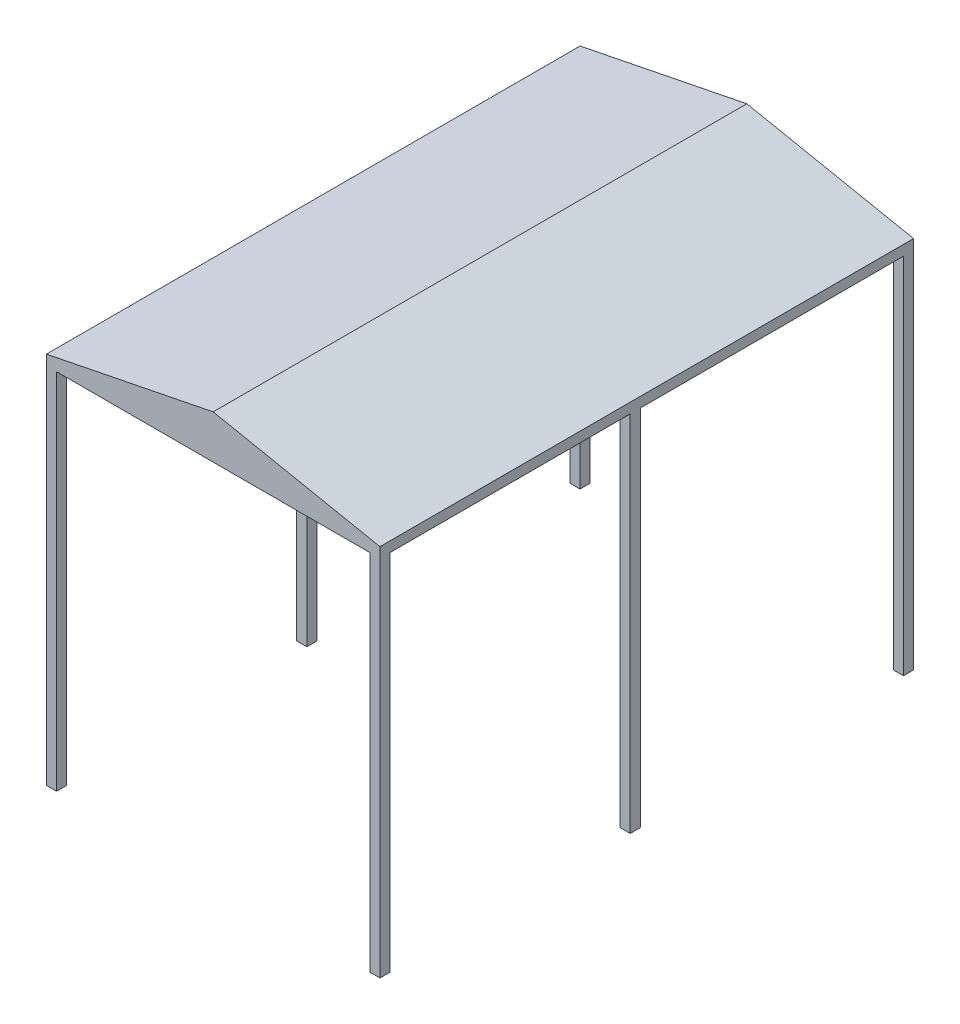
from build123d import *

# Parameters (mm, degrees)
CROQUIS1_W              = 2500
CROQUIS1_H              = 2800
SALIENTE_EXTRUIR1_DEPTH = 4000
CORTAR_EXTRUIR1_DEPTH   = 2723.8
CORTAR_EXTRUIR2_DEPTH   = 2723.8
SALIENTE_EXTRUIR2_DEPTH = 4000


with BuildPart() as part:
    # Croquis1 → Saliente-Extruir1 (new body)
    with BuildSketch(Plane.XY):
        with Locations((1250, 1400)):
            Rectangle(CROQUIS1_W, CROQUIS1_H)
    extrude(amount=SALIENTE_EXTRUIR1_DEPTH)

    # Croquis2 → Cortar-Extruir1 (cut)
    with BuildSketch(Plane.XZ):
        Polygon((76.2, 4000), (76.2, 3923.8), (0, 3923.8), (0, 2123.8), (76.2, 2123.8), (76.2, 2047.6), (2423.8, 2047.6), (2423.8, 2123.8), (2500, 2123.8), (2500, 3923.8), (2423.8, 3923.8), (2423.8, 4000), align=None)
    extrude(amount=-CORTAR_EXTRUIR1_DEPTH, mode=Mode.SUBTRACT)

    # Croquis3 → Cortar-Extruir2 (cut)
    with BuildSketch(Plane.XZ):
        Polygon((0, 76.2), (76.2, 76.2), (76.2, 0), (2423.8, 0), (2423.8, 76.2), (2500, 76.2), (2500, 2047.6), (0, 2047.6), align=None)
    extrude(amount=-CORTAR_EXTRUIR2_DEPTH, mode=Mode.SUBTRACT)

    # Croquis4 → Saliente-Extruir2 (add)
    with BuildSketch(Plane(origin=(0, 0, 0), x_dir=(-1, 0, 0), z_dir=(0, 0, -1))):
        Polygon((-2500, 2800), (-1250, 3050), (0, 2800), align=None)
    extrude(amount=-SALIENTE_EXTRUIR2_DEPTH)


solid = part.part
